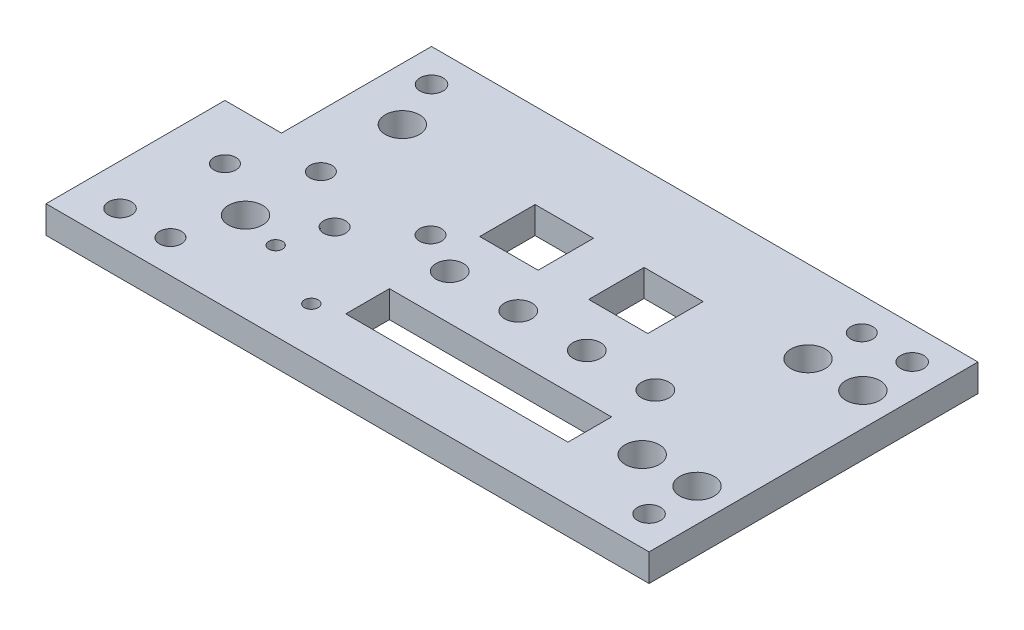
from build123d import *

# Parameters (mm, degrees)
SKETCH1_W                    = 220
SKETCH1_H                    = 120
BOSS_EXTRUDE1_DEPTH          = 10
CUT_EXTRUDE1_REACH           = 127.698
SKETCH2_W                    = 20.632503002
SKETCH2_H                    = 54.730004003
F_12_5_12_5_DIAMETER_HOLE1_D = 12.5
F_10_0_10_DIAMETER_HOLE1_D   = 10
F_5_0MM_DOWEL_HOLE1_D        = 5
CUT_EXTRUDE2_REACH           = 127.698
SKETCH12_R                   = 4
SKETCH12_W                   = 81.05559148
SKETCH12_H                   = 15.93559148
SKETCH12_W_2                 = 21.30559148
SKETCH12_H_2                 = 20.21559148
SKETCH12_W_3                 = 21.55559148
DRAFT1_ANGLE                 = -1
F_8_0MM_DOWEL_HOLE1_D        = 8
M8_CLEARANCE_HOLE1_D         = 8.4


with BuildPart() as part:
    # Sketch1 → Boss-Extrude1 (new body)
    with BuildSketch(Plane(origin=(0, 0, 0), x_dir=(1, 0, 0), z_dir=(0, 1, 0))):
        Rectangle(SKETCH1_W, SKETCH1_H)
    extrude(amount=-BOSS_EXTRUDE1_DEPTH)

    # Sketch2 → Cut-Extrude1 (cut, up to next)
    with BuildSketch(Plane(origin=(0, 0, 0), x_dir=(1, 0, 0), z_dir=(0, 1, 0)), mode=Mode.PRIVATE) as cut_extrude1_sk1:
        with Locations((-99.683748499, 32.634997999)):
            Rectangle(SKETCH2_W, SKETCH2_H)
    cut_extrude1_tool1 = extrude(cut_extrude1_sk1.sketch, amount=-CUT_EXTRUDE1_REACH, mode=Mode.PRIVATE) & part.part
    add(cut_extrude1_tool1.solids().sort_by_distance((-99.683748, 0, -32.634998))[0], mode=Mode.SUBTRACT)

    # Ø12.5 (12.5) Diameter Hole1 (through all)
    with Locations(Plane(origin=(0, -10, 0), x_dir=(-1, 0, 0), z_dir=(0, -1, 0))):
        with Locations((-98, 30), (-78, 30), (70, 30), (-98, -30.5), (-78, -30.5), (70, -27.22)):
            Hole(F_12_5_12_5_DIAMETER_HOLE1_D / 2)

    # Ø10.0 (10) Diameter Hole1 (through all)
    with Locations(Plane(origin=(0, -10, 0), x_dir=(-1, 0, 0), z_dir=(0, -1, 0))):
        with Locations((-60, -7.72), (-35, -7.72), (-10, -7.72), (15, -7.72)):
            Hole(F_10_0_10_DIAMETER_HOLE1_D / 2)

    # Ø5.0mm Dowel Hole1 (through all)
    with Locations(Plane(origin=(0, -10, 0), x_dir=(-1, 0, 0), z_dir=(0, -1, 0))):
        with Locations((30, -43.22), (55, -31.22)):
            Hole(F_5_0MM_DOWEL_HOLE1_D / 2)

    # Sketch12 → Cut-Extrude2 (cut, up to next)
    with BuildSketch(Plane.XZ.offset(10), mode=Mode.PRIVATE) as cut_extrude2_sk1:
        with Locations(Location((-90, 14.72, 0), (0, 0, 270))):
            Circle(SKETCH12_R)
    cut_extrude2_tool1 = extrude(cut_extrude2_sk1.sketch, amount=-CUT_EXTRUDE2_REACH, mode=Mode.PRIVATE) & part.part
    # Sketch12 → Cut-Extrude2 (cut, up to next)
    with BuildSketch(Plane.XZ.offset(10), mode=Mode.PRIVATE) as cut_extrude2_sk2:
        with Locations(Location((-70, -0.28, 0), (0, 0, 270))):
            Circle(SKETCH12_R)
    cut_extrude2_tool2 = extrude(cut_extrude2_sk2.sketch, amount=-CUT_EXTRUDE2_REACH, mode=Mode.PRIVATE) & part.part
    # Sketch12 → Cut-Extrude2 (cut, up to next)
    with BuildSketch(Plane.XZ.offset(10), mode=Mode.PRIVATE) as cut_extrude2_sk3:
        with Locations(Location((-50, 14.72, 0), (0, 0, 270))):
            Circle(SKETCH12_R)
    cut_extrude2_tool3 = extrude(cut_extrude2_sk3.sketch, amount=-CUT_EXTRUDE2_REACH, mode=Mode.PRIVATE) & part.part
    # Sketch12 → Cut-Extrude2 (cut, up to next)
    with BuildSketch(Plane.XZ.offset(10), mode=Mode.PRIVATE) as cut_extrude2_sk4:
        with Locations(Location((-30, -0.28, 0), (0, 0, 270))):
            Circle(SKETCH12_R)
    cut_extrude2_tool4 = extrude(cut_extrude2_sk4.sketch, amount=-CUT_EXTRUDE2_REACH, mode=Mode.PRIVATE) & part.part
    # Sketch12 → Cut-Extrude2 (cut, up to next)
    with BuildSketch(Plane.XZ.offset(10), mode=Mode.PRIVATE) as cut_extrude2_sk5:
        with Locations((20, 32.16)):
            Rectangle(SKETCH12_W, SKETCH12_H)
    cut_extrude2_tool5 = extrude(cut_extrude2_sk5.sketch, amount=-CUT_EXTRUDE2_REACH, mode=Mode.PRIVATE) & part.part
    # Sketch12 → Cut-Extrude2 (cut, up to next)
    with BuildSketch(Plane.XZ.offset(10), mode=Mode.PRIVATE) as cut_extrude2_sk6:
        with Locations((-9.875, -18.86)):
            Rectangle(SKETCH12_W_2, SKETCH12_H_2)
    cut_extrude2_tool6 = extrude(cut_extrude2_sk6.sketch, amount=-CUT_EXTRUDE2_REACH, mode=Mode.PRIVATE) & part.part
    # Sketch12 → Cut-Extrude2 (cut, up to next)
    with BuildSketch(Plane.XZ.offset(10), mode=Mode.PRIVATE) as cut_extrude2_sk7:
        with Locations((30, -18.86)):
            Rectangle(SKETCH12_W_3, SKETCH12_H_2)
    cut_extrude2_tool7 = extrude(cut_extrude2_sk7.sketch, amount=-CUT_EXTRUDE2_REACH, mode=Mode.PRIVATE) & part.part
    add(cut_extrude2_tool1.solids().sort_by_distance((-90, -10, 14.72))[0], mode=Mode.SUBTRACT)
    add(cut_extrude2_tool2.solids().sort_by_distance((-70, -10, -0.28))[0], mode=Mode.SUBTRACT)
    add(cut_extrude2_tool3.solids().sort_by_distance((-50, -10, 14.72))[0], mode=Mode.SUBTRACT)
    add(cut_extrude2_tool4.solids().sort_by_distance((-30, -10, -0.28))[0], mode=Mode.SUBTRACT)
    add(cut_extrude2_tool5.solids().sort_by_distance((20, -10, 32.16))[0], mode=Mode.SUBTRACT)
    add(cut_extrude2_tool6.solids().sort_by_distance((-9.875, -10, -18.86))[0], mode=Mode.SUBTRACT)
    add(cut_extrude2_tool7.solids().sort_by_distance((30, -10, -18.86))[0], mode=Mode.SUBTRACT)

    # Draft1
    draft1_faces = [part.faces().sort_by_distance(p)[0] for p in [
        (60.52779574, -5, 32.16),
        (20, -5, 40.12779574),
        (-20.52779574, -5, 32.16),
        (20, -5, 24.19220426),
        (-9.875, -5, -8.75220426),
        (30, -5, -8.75220426),
        (40.77779574, -5, -18.86),
        (0.77779574, -5, -18.86),
        (-20.52779574, -5, -18.86),
        (19.22220426, -5, -18.86),
        (30, -5, -28.96779574),
        (-9.875, -5, -28.96779574),
        (-50, -5, 18.72),
        (-30, -5, 3.72),
        (-70, -5, 3.72),
        (-90, -5, 18.72),
    ]]
    draft(draft1_faces, Plane.ZX, DRAFT1_ANGLE)

    # Ø8.0mm Dowel Hole1 (through all)
    with Locations(Plane(origin=(0, -10, 0), x_dir=(-1, 0, 0), z_dir=(0, -1, 0))):
        with Locations((76.6, -48), (-79.6, 48)):
            Hole(F_8_0MM_DOWEL_HOLE1_D / 2)

    # M8 Clearance Hole1 (through all)
    with Locations(Plane(origin=(0, 0, 0), x_dir=(1, 0, 0), z_dir=(0, 1, 0))):
        with Locations((-95, -48), (98, -48), (98, 48), (-77.367496998, 48)):
            Hole(M8_CLEARANCE_HOLE1_D / 2)


solid = part.part
